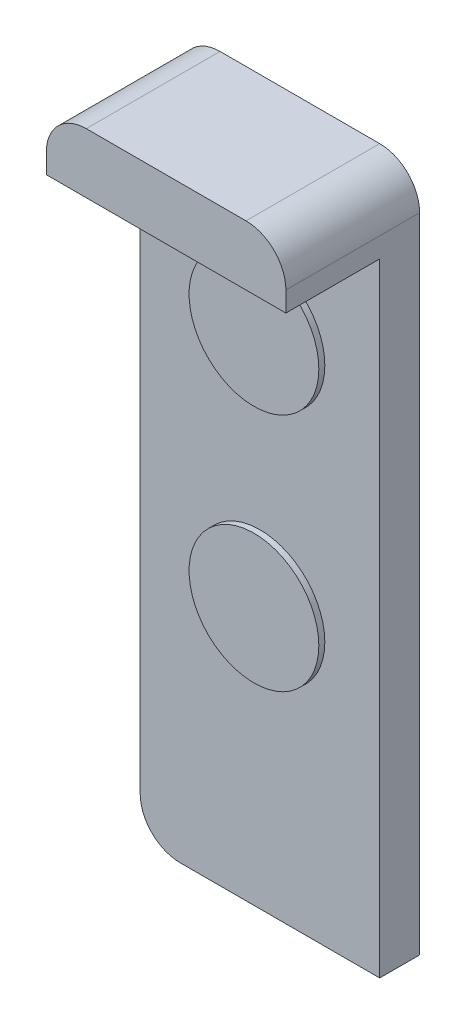
from build123d import *

# Parameters (mm, degrees)
ESQUISSE1_W        = 12
ESQUISSE1_H        = 34.2
BOSS_EXTRU_1_DEPTH = 2
ESQUISSE2_R        = 3.25
BOSS_EXTRU_2_DEPTH = 0.3
ESQUISSE3_W        = 12
ESQUISSE3_H        = 3
BOSS_EXTRU_3_DEPTH = 4.7
CONG_1_R           = 2


with BuildPart() as part:
    # Esquisse1 → Boss.-Extru.1 (new body)
    with BuildSketch(Plane.XY):
        with Locations((2.233800948, 3.291549296)):
            Rectangle(ESQUISSE1_W, ESQUISSE1_H)
    extrude(amount=BOSS_EXTRU_1_DEPTH)

    # Esquisse2 → Boss.-Extru.2 (add)
    with BuildSketch(Plane.XY.offset(2)):
        with Locations((2.233800948, 11.391549296)):
            Circle(ESQUISSE2_R)
        with Locations((2.233800948, -0.608450704)):
            Circle(ESQUISSE2_R)
    extrude(amount=BOSS_EXTRU_2_DEPTH)

    # Esquisse3 → Boss.-Extru.3 (add)
    with BuildSketch(Plane.XY.offset(2)):
        with Locations((2.233800948, 18.891549296)):
            Rectangle(ESQUISSE3_W, ESQUISSE3_H)
    extrude(amount=BOSS_EXTRU_3_DEPTH)

    # Congé1
    cong_1_edges = [part.edges().sort_by_distance(p)[0] for p in [
        (-3.766199052, 20.391549296, 3.35),
        (8.233800948, 20.391549296, 3.35),
        (-3.766199052, -13.808450704, 1),
    ]]
    fillet(cong_1_edges, radius=CONG_1_R)


solid = part.part
